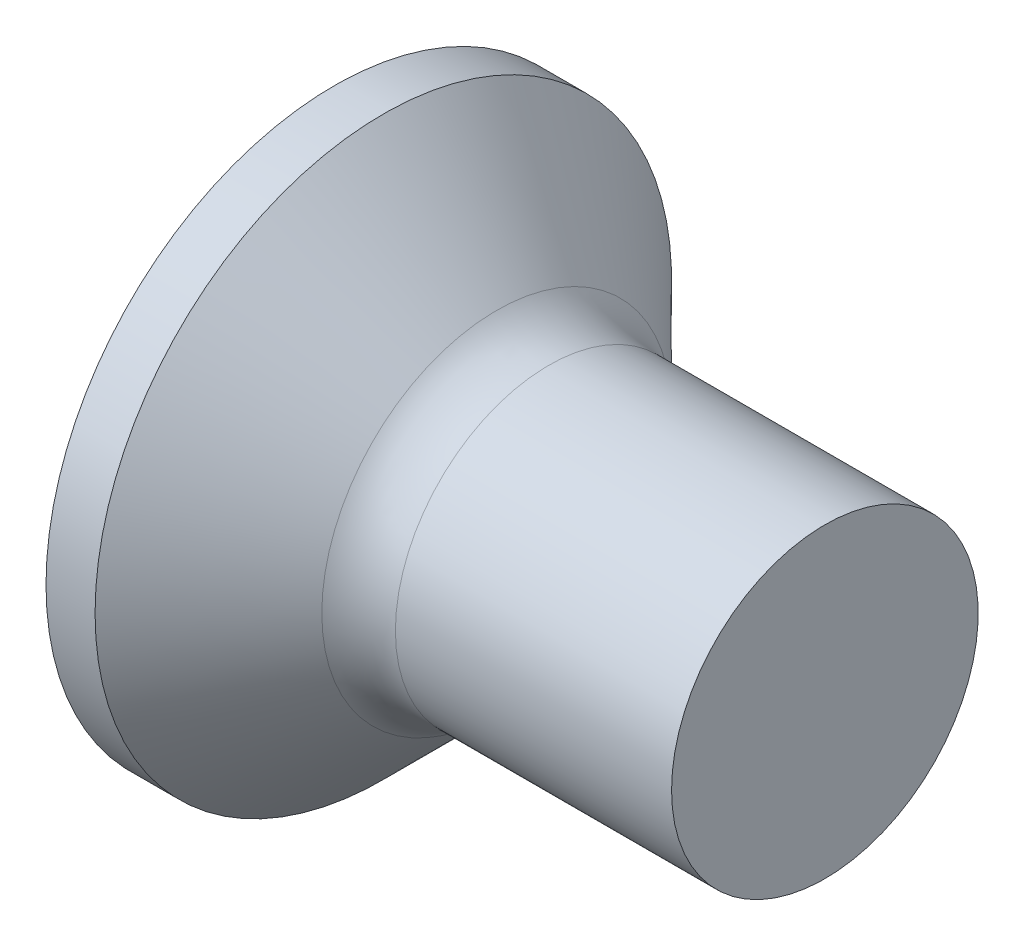
from build123d import *

# Parameters (mm, degrees)
FILLET1_R    = 0.6
RECPAT_COUNT = 2
RECPAT_ANGLE = 90


with BuildPart() as part:
    # BodySke → Base-Revolve (revolve)
    with BuildSketch(Plane.XY, mode=Mode.PRIVATE) as base_revolve_sk:
        Polygon((0, 0), (0, 2.35), (0.4, 2.35), (1.5, 1.25), (4, 1.25), (4, 0), align=None)
    revolve(base_revolve_sk.sketch.rotate(Axis((-6.35, 0, 0), (1, 0, 0)), 90), axis=Axis((-6.35, 0, 0), (1, 0, 0)))

    # Fillet1
    fillet1_edges = [part.edges().sort_by_distance(p)[0] for p in [
        (1.5, 0, -1.25),
    ]]
    fillet(fillet1_edges, radius=FILLET1_R)

    # Sketch3 → Recess section 0
    with BuildSketch(Plane.ZY):
        with BuildLine():
            Line((-0.37, 1.4), (0.37, 1.4))
            Line((0.37, 1.4), (0.37, -1.4))
            Line((0.37, -1.4), (-0.37, -1.4))
            Line((-0.37, -1.4), (-0.37, 1.4))
        make_face()
    # Sketch4 → Recess section 1
    with BuildSketch(Plane.ZY.offset(-1.73)):
        with BuildLine():
            Line((-0.37, 0.537453962), (0.37, 0.537453962))
            Line((0.37, 0.537453962), (0.37, -0.537453962))
            Line((0.37, -0.537453962), (-0.37, -0.537453962))
            Line((-0.37, -0.537453962), (-0.37, 0.537453962))
        make_face()
    recess = loft(mode=Mode.SUBTRACT)

    # RecPat: Recess ×2 about axis
    recpat_axis = Axis((0, 0, 0), (1, 0, 0))
    for i in range(1, RECPAT_COUNT):
        add(recess.rotate(recpat_axis, i * RECPAT_ANGLE / (RECPAT_COUNT - 1)), mode=Mode.SUBTRACT)

    # RecCorSke → RecessCore (revolve, cut)
    with BuildSketch(Plane.XY, mode=Mode.PRIVATE) as recesscore_sk:
        Polygon((0, 0), (0, 0.676973385), (1.73, 0.556), (1.910655351, 0), align=None)
    revolve(recesscore_sk.sketch.rotate(Axis((-3.175, 0, 0), (1, 0, 0)), 90), axis=Axis((-3.175, 0, 0), (1, 0, 0)), mode=Mode.SUBTRACT)


solid = part.part
